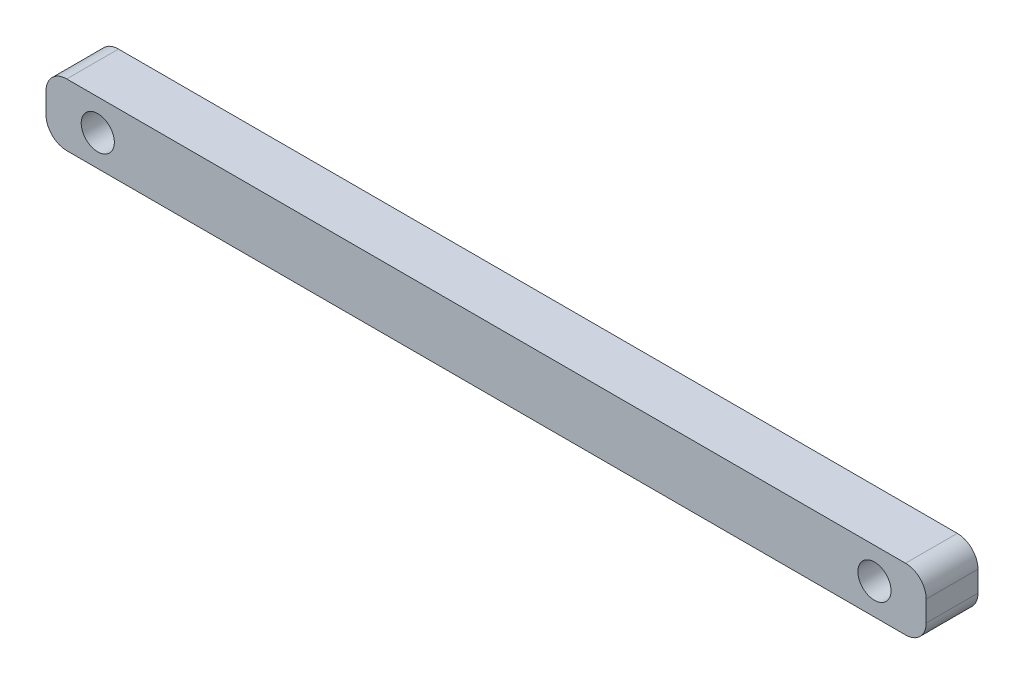
from build123d import *

# Parameters (mm, degrees)
SKETCH1_R           = 1.6
BOSS_EXTRUDE1_DEPTH = 5


with BuildPart() as part:
    # Sketch1 → Boss-Extrude1 (new body)
    with BuildSketch(Plane.XY):
        with BuildLine():
            Line((-40.5, 3), (40.5, 3))
            ThreePointArc((40.5, 3), (41.914213562, 2.414213562), (42.5, 1))
            Line((42.5, 1), (42.5, -1))
            ThreePointArc((42.5, -1), (41.914213562, -2.414213562), (40.5, -3))
            Line((40.5, -3), (-40.5, -3))
            ThreePointArc((-40.5, -3), (-41.914213562, -2.414213562), (-42.5, -1))
            Line((-42.5, -1), (-42.5, 1))
            ThreePointArc((-42.5, 1), (-41.914213562, 2.414213562), (-40.5, 3))
        make_face()
        with Locations((-37.5, 0)):
            Circle(SKETCH1_R, mode=Mode.SUBTRACT)
        with Locations((37.5, 0)):
            Circle(SKETCH1_R, mode=Mode.SUBTRACT)
    extrude(amount=BOSS_EXTRUDE1_DEPTH)


solid = part.part
